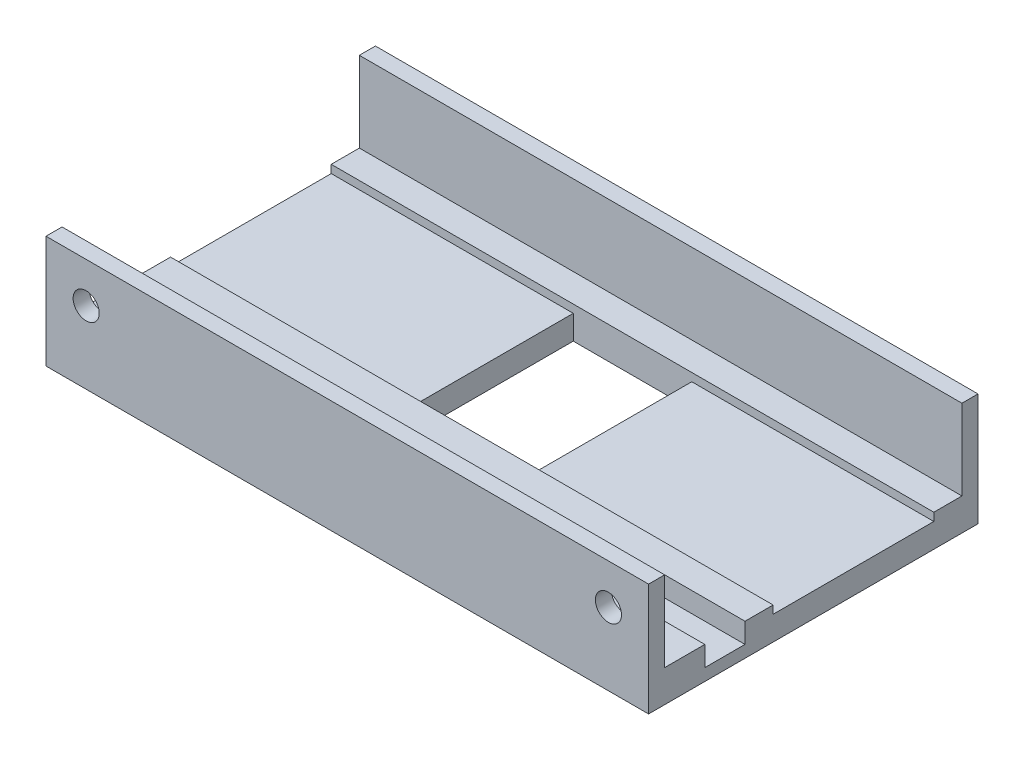
from build123d import *

# Parameters (mm, degrees)
SKETCH1_W           = 75
SKETCH1_H           = 41
BOSS_EXTRUDE1_DEPTH = 4
SKETCH2_W           = 75
SKETCH2_H           = 2
BOSS_EXTRUDE2_DEPTH = 10
SKETCH3_W           = 75
SKETCH3_H           = 2
BOSS_EXTRUDE3_DEPTH = 10
SKETCH6_W           = 14.75
SKETCH6_H           = 20
CUT_EXTRUDE3_DEPTH  = 44.891912695
SKETCH7_W           = 75
SKETCH7_H           = 20
CUT_EXTRUDE4_DEPTH  = 1
SKETCH10_R          = 1.625
CUT_EXTRUDE5_DEPTH  = 2
SKETCH11_W          = 10.5
SKETCH11_H          = 5
CUT_EXTRUDE6_DEPTH  = 2.5


with BuildPart() as part:
    # Sketch1 → Boss-Extrude1 (new body)
    with BuildSketch(Plane(origin=(0, 0, 0), x_dir=(1, 0, 0), z_dir=(0, 1, 0))):
        Rectangle(SKETCH1_W, SKETCH1_H)
    extrude(amount=BOSS_EXTRUDE1_DEPTH)

    # Sketch2 → Boss-Extrude2 (add)
    with BuildSketch(Plane(origin=(0, 4, 0), x_dir=(1, 0, 0), z_dir=(0, 1, 0))):
        with Locations((0, 19.5)):
            Rectangle(SKETCH2_W, SKETCH2_H)
    extrude(amount=BOSS_EXTRUDE2_DEPTH)

    # Sketch3 → Boss-Extrude3 (add)
    with BuildSketch(Plane(origin=(0, 4, 0), x_dir=(1, 0, 0), z_dir=(0, 1, 0))):
        with Locations((0, -19.5)):
            Rectangle(SKETCH3_W, SKETCH3_H)
    extrude(amount=BOSS_EXTRUDE3_DEPTH)

    # Sketch6 → Cut-Extrude3 (cut, through all)
    with BuildSketch(Plane(origin=(0, 4, 0), x_dir=(1, 0, 0), z_dir=(0, 1, 0))):
        with Locations((0, 5)):
            Rectangle(SKETCH6_W, SKETCH6_H)
    extrude(amount=-CUT_EXTRUDE3_DEPTH, mode=Mode.SUBTRACT)

    # Sketch7 → Cut-Extrude4 (cut)
    with BuildSketch(Plane(origin=(0, 4, 0), x_dir=(1, 0, 0), z_dir=(0, 1, 0))):
        with Locations((0, 5)):
            Rectangle(SKETCH7_W, SKETCH7_H)
    extrude(amount=-CUT_EXTRUDE4_DEPTH, mode=Mode.SUBTRACT)

    # Sketch10 → Cut-Extrude5 (cut)
    with BuildSketch(Plane.XY.offset(20.5)):
        with Locations((-32.5, 9)):
            Circle(SKETCH10_R)
        with Locations((32.5, 9)):
            Circle(SKETCH10_R)
    extrude(amount=-CUT_EXTRUDE5_DEPTH, mode=Mode.SUBTRACT)

    # Sketch11 → Cut-Extrude6 (cut)
    with BuildSketch(Plane(origin=(0, 4, 0), x_dir=(1, 0, 0), z_dir=(0, 1, 0))):
        with Locations((-32.25, -11)):
            Rectangle(SKETCH11_W, SKETCH11_H)
        with Locations((32.25, -11)):
            Rectangle(SKETCH11_W, SKETCH11_H)
    extrude(amount=-CUT_EXTRUDE6_DEPTH, mode=Mode.SUBTRACT)


solid = part.part
